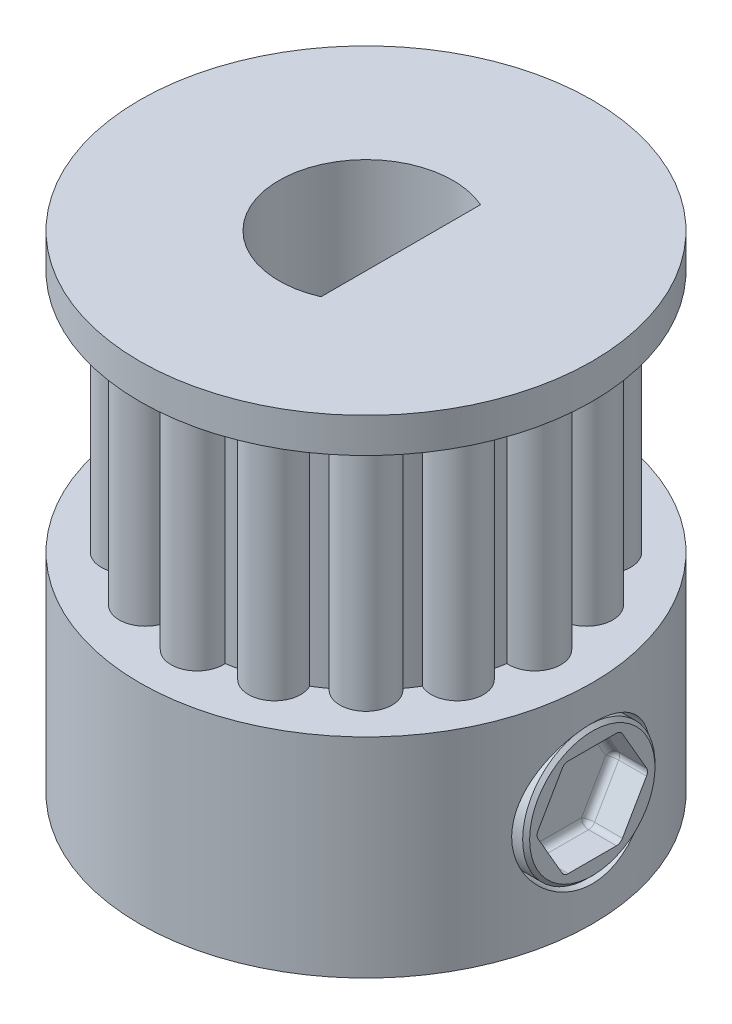
from build123d import *

# Parameters (mm, degrees)
BOSS_EXTRUDE1_DEPTH = 7
BOSS_EXTRUDE2_START = 14
BOSS_EXTRUDE2_DEPTH = 14
SKETCH4_R           = 2
CUT_EXTRUDE1_DEPTH  = 18.161002302
SKETCH5_R           = 1.9
BOSS_EXTRUDE3_DEPTH = 5.5
CUT_EXTRUDE2_DEPTH  = 1
FILLET1_R           = 0.2
CHAMFER1_SIZE       = 0.1


with BuildPart() as part:
    # Sketch1 → Revolve1 (revolve)
    with BuildSketch(Plane.XY, mode=Mode.PRIVATE) as revolve1_sk:
        Polygon((2.5, 0), (2.5, 14), (6.5, 14), (6.5, 13), (4.85, 13), (4.85, 6), (6.5, 6), (6.5, 0), align=None)
    revolve(revolve1_sk.sketch.rotate(Axis((0, 0, 0), (0, 1, 0)), 90), axis=Axis((0, 0, 0), (0, 1, 0)))

    # Sketch2 → Boss-Extrude1 (add)
    with BuildSketch(Plane(origin=(0, 6, 0), x_dir=(1, 0, 0), z_dir=(0, 1, 0))):
        with BuildLine():
            ThreePointArc((4.792010309, 0.74775477), (4.85, 0), (4.792010309, -0.74775477))
            ThreePointArc((4.792010309, -0.74775477), (5.6, 0), (4.792010309, 0.74775477))
        make_face()
        with BuildLine():
            ThreePointArc((4.141086882, 2.52465828), (4.480815733, 1.856014647), (4.713393606, 1.142987626))
            ThreePointArc((4.713393606, 1.142987626), (5.173725382, 2.143027221), (4.141086882, 2.52465828))
        make_face()
        with BuildLine():
            ThreePointArc((4.141086882, -2.52465828), (5.173725382, -2.143027221), (4.713393606, -1.142987626))
            ThreePointArc((4.713393606, -1.142987626), (4.480815733, -1.856014647), (4.141086882, -2.52465828))
        make_face()
        with BuildLine():
            ThreePointArc((2.859720517, 3.917205454), (3.429467889, 3.429467889), (3.917205454, 2.859720517))
            ThreePointArc((3.917205454, 2.859720517), (3.959797975, 3.959797975), (2.859720517, 3.917205454))
        make_face()
        with BuildLine():
            ThreePointArc((2.859720517, -3.917205454), (3.959797975, -3.959797975), (3.917205454, -2.859720517))
            ThreePointArc((3.917205454, -2.859720517), (3.429467889, -3.429467889), (2.859720517, -3.917205454))
        make_face()
        with BuildLine():
            ThreePointArc((1.142987626, 4.713393606), (1.856014647, 4.480815733), (2.52465828, 4.141086882))
            ThreePointArc((2.52465828, 4.141086882), (2.143027221, 5.173725382), (1.142987626, 4.713393606))
        make_face()
        with BuildLine():
            ThreePointArc((1.142987626, -4.713393606), (2.143027221, -5.173725382), (2.52465828, -4.141086882))
            ThreePointArc((2.52465828, -4.141086882), (1.856014647, -4.480815733), (1.142987626, -4.713393606))
        make_face()
        with BuildLine():
            ThreePointArc((-0.74775477, 4.792010309), (0, 4.85), (0.74775477, 4.792010309))
            ThreePointArc((0.74775477, 4.792010309), (0, 5.6), (-0.74775477, 4.792010309))
        make_face()
        with BuildLine():
            ThreePointArc((-0.74775477, -4.792010309), (0, -5.6), (0.74775477, -4.792010309))
            ThreePointArc((0.74775477, -4.792010309), (0, -4.85), (-0.74775477, -4.792010309))
        make_face()
        with BuildLine():
            ThreePointArc((-2.52465828, 4.141086882), (-1.856014647, 4.480815733), (-1.142987626, 4.713393606))
            ThreePointArc((-1.142987626, 4.713393606), (-2.143027221, 5.173725382), (-2.52465828, 4.141086882))
        make_face()
        with BuildLine():
            ThreePointArc((-2.52465828, -4.141086882), (-2.143027221, -5.173725382), (-1.142987626, -4.713393606))
            ThreePointArc((-1.142987626, -4.713393606), (-1.856014647, -4.480815733), (-2.52465828, -4.141086882))
        make_face()
        with BuildLine():
            ThreePointArc((-3.917205454, 2.859720517), (-3.429467889, 3.429467889), (-2.859720517, 3.917205454))
            ThreePointArc((-2.859720517, 3.917205454), (-3.959797975, 3.959797975), (-3.917205454, 2.859720517))
        make_face()
        with BuildLine():
            ThreePointArc((-3.917205454, -2.859720517), (-3.959797975, -3.959797975), (-2.859720517, -3.917205454))
            ThreePointArc((-2.859720517, -3.917205454), (-3.429467889, -3.429467889), (-3.917205454, -2.859720517))
        make_face()
        with BuildLine():
            ThreePointArc((-4.713393606, 1.142987626), (-4.480815733, 1.856014647), (-4.141086882, 2.52465828))
            ThreePointArc((-4.141086882, 2.52465828), (-5.173725382, 2.143027221), (-4.713393606, 1.142987626))
        make_face()
        with BuildLine():
            ThreePointArc((-4.713393606, -1.142987626), (-5.173725382, -2.143027221), (-4.141086882, -2.52465828))
            ThreePointArc((-4.141086882, -2.52465828), (-4.480815733, -1.856014647), (-4.713393606, -1.142987626))
        make_face()
        with BuildLine():
            ThreePointArc((-4.792010309, -0.74775477), (-4.85, 0), (-4.792010309, 0.74775477))
            ThreePointArc((-4.792010309, 0.74775477), (-5.6, 0), (-4.792010309, -0.74775477))
        make_face()
    extrude(amount=BOSS_EXTRUDE1_DEPTH)

    # Sketch3 → Boss-Extrude2 (add)
    with BuildSketch(Plane(origin=(0, 0, 0), x_dir=(1, 0, 0), z_dir=(0, 1, 0)).offset(BOSS_EXTRUDE2_START)):
        with BuildLine():
            Line((1, 2.291287847), (1, -2.291287847))
            ThreePointArc((1, -2.291287847), (2.5, 0), (1, 2.291287847))
        make_face()
    extrude(amount=-BOSS_EXTRUDE2_DEPTH)

    # Sketch4 → Cut-Extrude1 (cut, through all)
    with BuildSketch(Plane.ZY.offset(-1)):
        with Locations((0, 3)):
            Circle(SKETCH4_R)
    extrude(amount=-CUT_EXTRUDE1_DEPTH, mode=Mode.SUBTRACT)


with BuildPart() as body_2:
    # Sketch5 → Boss-Extrude3 (new body)
    with BuildSketch(Plane.ZY.offset(-1)):
        with Locations((0, 3)):
            Circle(SKETCH5_R)
    extrude(amount=-BOSS_EXTRUDE3_DEPTH)

    # Sketch6 → Cut-Extrude2 (cut)
    with BuildSketch(Plane(origin=(6.5, 0, 0), x_dir=(0, 0, -1), z_dir=(1, 0, 0))):
        Polygon((1.616580754, 3), (0.808290377, 4.4), (-0.808290377, 4.4), (-1.616580754, 3), (-0.808290377, 1.6), (0.808290377, 1.6), align=None)
    extrude(amount=-CUT_EXTRUDE2_DEPTH, mode=Mode.SUBTRACT)

    # Fillet1
    fillet1_edges = [body_2.edges().sort_by_distance(p)[0] for p in [
        (6, 3, 1.616580754),
        (5.5, 4.4, 0),
        (6, 4.4, 0.808290377),
        (5.5, 3.7, -1.212435565),
        (6, 4.4, -0.808290377),
        (5.5, 2.3, -1.212435565),
        (6, 3, -1.616580754),
        (5.5, 1.6, 0),
        (6, 1.6, -0.808290377),
        (5.5, 2.3, 1.212435565),
        (6, 1.6, 0.808290377),
        (5.5, 3.7, 1.212435565),
    ]]
    fillet(fillet1_edges, radius=FILLET1_R)

    # Chamfer1
    chamfer1_edges = [body_2.edges().sort_by_distance(p)[0] for p in [
        (6.5, 3, -1.9),
    ]]
    chamfer(chamfer1_edges, length=CHAMFER1_SIZE)


solid = Compound([part.part, body_2.part])
